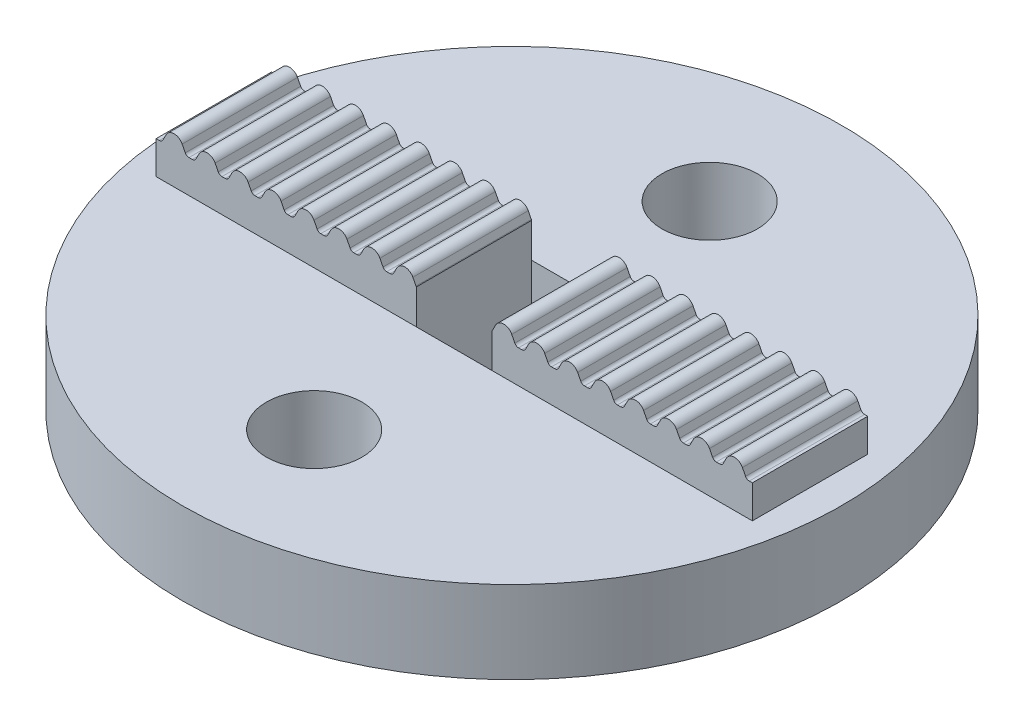
from build123d import *

# Parameters (mm, degrees)
BOSS_EXTRUDE1_DEPTH     = 7
BOSS_EXTRUDE2_START     = -2
SKETCH2_R               = 20
BOSS_EXTRUDE2_DEPTH     = 5
CUT_EXTRUDE2_DEPTH      = 46.034410177
CUT_EXTRUDE2_DEPTH_BACK = 46.034410177
SKETCH4_W               = 4.6
SKETCH4_H               = 7
M5_CLEARANCE_HOLE1_D    = 5.8


with BuildPart() as part:
    # Sketch1 → Boss-Extrude1 (new body)
    with BuildSketch(Plane.XY):
        with BuildLine():
            Line((3.767777778, 0.135469288), (3.578888889, 0.501967566))
            ThreePointArc((3.578888889, 0.501967566), (3.09, 0.8), (2.601111111, 0.501967566))
            Line((2.601111111, 0.501967566), (2.412222222, 0.135469288))
            ThreePointArc((2.412222222, 0.135469288), (2.320129401, 0.036537266), (2.19, 0))
            Line((2.19, 0), (2.18, 0))
            Line((2.18, 0), (2, 0))
            Line((2, 0), (1.99, 0))
            ThreePointArc((1.99, 0), (1.859870599, 0.036537266), (1.767777778, 0.135469288))
            Line((1.767777778, 0.135469288), (1.578888889, 0.501967566))
            ThreePointArc((1.578888889, 0.501967566), (1.09, 0.8), (0.601111111, 0.501967566))
            Line((0.601111111, 0.501967566), (0.412222222, 0.135469288))
            ThreePointArc((0.412222222, 0.135469288), (0.320129401, 0.036537266), (0.19, 0))
            Line((0.19, 0), (0, 0))
            Line((0, 0), (0, -5))
            Line((0, -5), (36.18, -5))
            Line((36.18, -5), (36.18, 0))
            Line((36.18, 0), (35.99, 0))
            ThreePointArc((35.99, 0), (35.859870599, 0.036537266), (35.767777778, 0.135469288))
            Line((35.767777778, 0.135469288), (35.578888889, 0.501967566))
            ThreePointArc((35.578888889, 0.501967566), (35.09, 0.8), (34.601111111, 0.501967566))
            Line((34.601111111, 0.501967566), (34.412222222, 0.135469288))
            ThreePointArc((34.412222222, 0.135469288), (34.320129401, 0.036537266), (34.19, 0))
            Line((34.19, 0), (34.18, 0))
            Line((34.18, 0), (34, 0))
            Line((34, 0), (33.99, 0))
            ThreePointArc((33.99, 0), (33.859870599, 0.036537266), (33.767777778, 0.135469288))
            Line((33.767777778, 0.135469288), (33.578888889, 0.501967566))
            ThreePointArc((33.578888889, 0.501967566), (33.09, 0.8), (32.601111111, 0.501967566))
            Line((32.601111111, 0.501967566), (32.412222222, 0.135469288))
            ThreePointArc((32.412222222, 0.135469288), (32.320129401, 0.036537266), (32.19, 0))
            Line((32.19, 0), (32.18, 0))
            Line((32.18, 0), (32, 0))
            Line((32, 0), (31.99, 0))
            ThreePointArc((31.99, 0), (31.859870599, 0.036537266), (31.767777778, 0.135469288))
            Line((31.767777778, 0.135469288), (31.578888889, 0.501967566))
            ThreePointArc((31.578888889, 0.501967566), (31.09, 0.8), (30.601111111, 0.501967566))
            Line((30.601111111, 0.501967566), (30.412222222, 0.135469288))
            ThreePointArc((30.412222222, 0.135469288), (30.320129401, 0.036537266), (30.19, 0))
            Line((30.19, 0), (30.18, 0))
            Line((30.18, 0), (30, 0))
            Line((30, 0), (29.99, 0))
            ThreePointArc((29.99, 0), (29.859870599, 0.036537266), (29.767777778, 0.135469288))
            Line((29.767777778, 0.135469288), (29.578888889, 0.501967566))
            ThreePointArc((29.578888889, 0.501967566), (29.09, 0.8), (28.601111111, 0.501967566))
            Line((28.601111111, 0.501967566), (28.412222222, 0.135469288))
            ThreePointArc((28.412222222, 0.135469288), (28.320129401, 0.036537266), (28.19, 0))
            Line((28.19, 0), (28.18, 0))
            Line((28.18, 0), (28, 0))
            Line((28, 0), (27.99, 0))
            ThreePointArc((27.99, 0), (27.859870599, 0.036537266), (27.767777778, 0.135469288))
            Line((27.767777778, 0.135469288), (27.578888889, 0.501967566))
            ThreePointArc((27.578888889, 0.501967566), (27.09, 0.8), (26.601111111, 0.501967566))
            Line((26.601111111, 0.501967566), (26.412222222, 0.135469288))
            ThreePointArc((26.412222222, 0.135469288), (26.320129401, 0.036537266), (26.19, 0))
            Line((26.19, 0), (26.18, 0))
            Line((26.18, 0), (26, 0))
            Line((26, 0), (25.99, 0))
            ThreePointArc((25.99, 0), (25.859870599, 0.036537266), (25.767777778, 0.135469288))
            Line((25.767777778, 0.135469288), (25.578888889, 0.501967566))
            ThreePointArc((25.578888889, 0.501967566), (25.09, 0.8), (24.601111111, 0.501967566))
            Line((24.601111111, 0.501967566), (24.412222222, 0.135469288))
            ThreePointArc((24.412222222, 0.135469288), (24.320129401, 0.036537266), (24.19, 0))
            Line((24.19, 0), (24.18, 0))
            Line((24.18, 0), (24, 0))
            Line((24, 0), (23.99, 0))
            ThreePointArc((23.99, 0), (23.859870599, 0.036537266), (23.767777778, 0.135469288))
            Line((23.767777778, 0.135469288), (23.578888889, 0.501967566))
            ThreePointArc((23.578888889, 0.501967566), (23.09, 0.8), (22.601111111, 0.501967566))
            Line((22.601111111, 0.501967566), (22.412222222, 0.135469288))
            ThreePointArc((22.412222222, 0.135469288), (22.320129401, 0.036537266), (22.19, 0))
            Line((22.19, 0), (22.18, 0))
            Line((22.18, 0), (22, 0))
            Line((22, 0), (21.99, 0))
            ThreePointArc((21.99, 0), (21.859870599, 0.036537266), (21.767777778, 0.135469288))
            Line((21.767777778, 0.135469288), (21.578888889, 0.501967566))
            ThreePointArc((21.578888889, 0.501967566), (21.09, 0.8), (20.601111111, 0.501967566))
            Line((20.601111111, 0.501967566), (20.412222222, 0.135469288))
            ThreePointArc((20.412222222, 0.135469288), (20.320129401, 0.036537266), (20.19, 0))
            Line((20.19, 0), (20.18, 0))
            Line((20.18, 0), (20, 0))
            Line((20, 0), (19.99, 0))
            ThreePointArc((19.99, 0), (19.859870599, 0.036537266), (19.767777778, 0.135469288))
            Line((19.767777778, 0.135469288), (19.578888889, 0.501967566))
            ThreePointArc((19.578888889, 0.501967566), (19.09, 0.8), (18.601111111, 0.501967566))
            Line((18.601111111, 0.501967566), (18.412222222, 0.135469288))
            ThreePointArc((18.412222222, 0.135469288), (18.320129401, 0.036537266), (18.19, 0))
            Line((18.19, 0), (18.18, 0))
            Line((18.18, 0), (18, 0))
            Line((18, 0), (17.99, 0))
            ThreePointArc((17.99, 0), (17.859870599, 0.036537266), (17.767777778, 0.135469288))
            Line((17.767777778, 0.135469288), (17.578888889, 0.501967566))
            ThreePointArc((17.578888889, 0.501967566), (17.09, 0.8), (16.601111111, 0.501967566))
            Line((16.601111111, 0.501967566), (16.412222222, 0.135469288))
            ThreePointArc((16.412222222, 0.135469288), (16.320129401, 0.036537266), (16.19, 0))
            Line((16.19, 0), (16.18, 0))
            Line((16.18, 0), (16, 0))
            Line((16, 0), (15.99, 0))
            ThreePointArc((15.99, 0), (15.859870599, 0.036537266), (15.767777778, 0.135469288))
            Line((15.767777778, 0.135469288), (15.578888889, 0.501967566))
            ThreePointArc((15.578888889, 0.501967566), (15.09, 0.8), (14.601111111, 0.501967566))
            Line((14.601111111, 0.501967566), (14.412222222, 0.135469288))
            ThreePointArc((14.412222222, 0.135469288), (14.320129401, 0.036537266), (14.19, 0))
            Line((14.19, 0), (14.18, 0))
            Line((14.18, 0), (14, 0))
            Line((14, 0), (13.99, 0))
            ThreePointArc((13.99, 0), (13.859870599, 0.036537266), (13.767777778, 0.135469288))
            Line((13.767777778, 0.135469288), (13.578888889, 0.501967566))
            ThreePointArc((13.578888889, 0.501967566), (13.09, 0.8), (12.601111111, 0.501967566))
            Line((12.601111111, 0.501967566), (12.412222222, 0.135469288))
            ThreePointArc((12.412222222, 0.135469288), (12.320129401, 0.036537266), (12.19, 0))
            Line((12.19, 0), (12.18, 0))
            Line((12.18, 0), (12, 0))
            Line((12, 0), (11.99, 0))
            ThreePointArc((11.99, 0), (11.859870599, 0.036537266), (11.767777778, 0.135469288))
            Line((11.767777778, 0.135469288), (11.578888889, 0.501967566))
            ThreePointArc((11.578888889, 0.501967566), (11.09, 0.8), (10.601111111, 0.501967566))
            Line((10.601111111, 0.501967566), (10.412222222, 0.135469288))
            ThreePointArc((10.412222222, 0.135469288), (10.320129401, 0.036537266), (10.19, 0))
            Line((10.19, 0), (10.18, 0))
            Line((10.18, 0), (10, 0))
            Line((10, 0), (9.99, 0))
            ThreePointArc((9.99, 0), (9.859870599, 0.036537266), (9.767777778, 0.135469288))
            Line((9.767777778, 0.135469288), (9.578888889, 0.501967566))
            ThreePointArc((9.578888889, 0.501967566), (9.09, 0.8), (8.601111111, 0.501967566))
            Line((8.601111111, 0.501967566), (8.412222222, 0.135469288))
            ThreePointArc((8.412222222, 0.135469288), (8.320129401, 0.036537266), (8.19, 0))
            Line((8.19, 0), (8.18, 0))
            Line((8.18, 0), (8, 0))
            Line((8, 0), (7.99, 0))
            ThreePointArc((7.99, 0), (7.859870599, 0.036537266), (7.767777778, 0.135469288))
            Line((7.767777778, 0.135469288), (7.578888889, 0.501967566))
            ThreePointArc((7.578888889, 0.501967566), (7.09, 0.8), (6.601111111, 0.501967566))
            Line((6.601111111, 0.501967566), (6.412222222, 0.135469288))
            ThreePointArc((6.412222222, 0.135469288), (6.320129401, 0.036537266), (6.19, 0))
            Line((6.19, 0), (6.18, 0))
            Line((6.18, 0), (6, 0))
            Line((6, 0), (5.99, 0))
            ThreePointArc((5.99, 0), (5.859870599, 0.036537266), (5.767777778, 0.135469288))
            Line((5.767777778, 0.135469288), (5.578888889, 0.501967566))
            ThreePointArc((5.578888889, 0.501967566), (5.09, 0.8), (4.601111111, 0.501967566))
            Line((4.601111111, 0.501967566), (4.412222222, 0.135469288))
            ThreePointArc((4.412222222, 0.135469288), (4.320129401, 0.036537266), (4.19, 0))
            Line((4.19, 0), (4.18, 0))
            Line((4.18, 0), (4, 0))
            Line((4, 0), (3.99, 0))
            ThreePointArc((3.99, 0), (3.859870599, 0.036537266), (3.767777778, 0.135469288))
        make_face()
    extrude(amount=BOSS_EXTRUDE1_DEPTH)

    # Sketch2 → Boss-Extrude2 (add)
    with BuildSketch(Plane(origin=(0, 0, 0), x_dir=(1, 0, 0), z_dir=(0, 1, 0)).offset(BOSS_EXTRUDE2_START)):
        with Locations(Location((18.09, -3.5, 0), (0, 0, 270))):
            Circle(SKETCH2_R)
    extrude(amount=-BOSS_EXTRUDE2_DEPTH)

    # Sketch4 → Cut-Extrude2 (cut, two sides: drawn at the far end of the back side and taken through both)
    with BuildSketch(Plane(origin=(0, -2, 0), x_dir=(1, 0, 0), z_dir=(0, 1, 0)).offset(-CUT_EXTRUDE2_DEPTH_BACK)):
        with Locations((18.09, -3.5)):
            Rectangle(SKETCH4_W, SKETCH4_H)
    extrude(amount=CUT_EXTRUDE2_DEPTH + CUT_EXTRUDE2_DEPTH_BACK, mode=Mode.SUBTRACT)

    # M5 Clearance Hole1 (through all)
    with Locations(Plane(origin=(18.09, -7, 15.5), x_dir=(0, 0, -1), z_dir=(0, -1, 0))):
        with Locations((0, 0), (24, 0)):
            Hole(M5_CLEARANCE_HOLE1_D / 2)


solid = part.part
